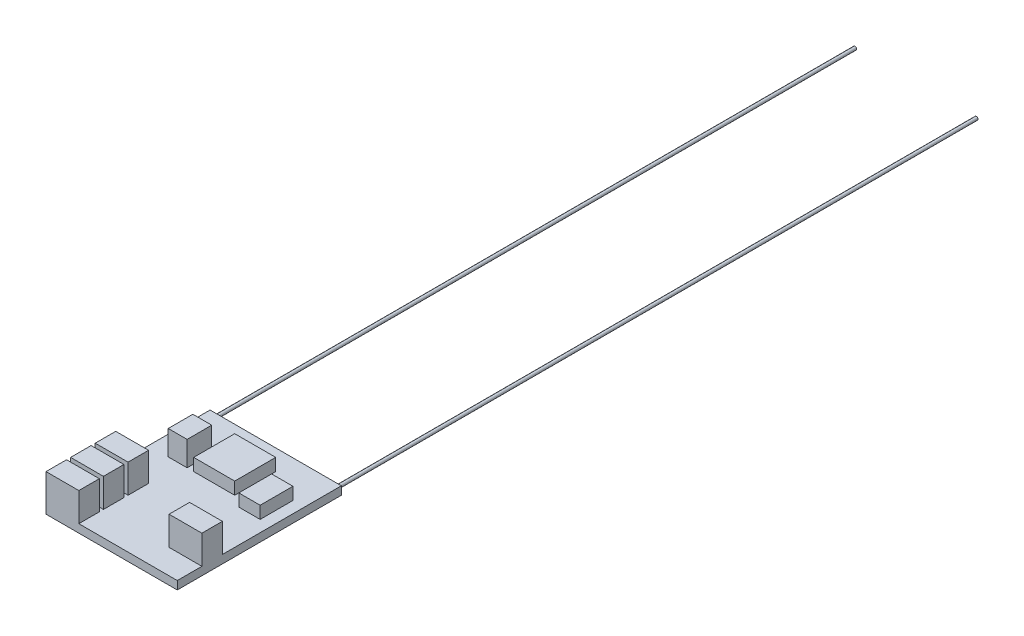
from build123d import *

# Parameters (mm, degrees)
SKETCH1_W           = 16
SKETCH1_H           = 20
BOSS_EXTRUDE1_DEPTH = 1
SKETCH2_W           = 4
SKETCH2_H           = 2.5
BOSS_EXTRUDE2_DEPTH = 3.5
SKETCH3_W           = 5
SKETCH3_H           = 5
SKETCH3_W_2         = 2.6
SKETCH3_H_2         = 4
BOSS_EXTRUDE3_DEPTH = 1.5
SKETCH4_W           = 2.302574488
SKETCH4_H           = 3
BOSS_EXTRUDE4_DEPTH = 3
SKETCH5_R           = 0.2
BOSS_EXTRUDE5_DEPTH = 78


with BuildPart() as part:
    # Sketch1 → Boss-Extrude1 (new body)
    with BuildSketch(Plane(origin=(0, 0, 0), x_dir=(1, 0, 0), z_dir=(0, 1, 0))):
        Rectangle(SKETCH1_W, SKETCH1_H)
    extrude(amount=BOSS_EXTRUDE1_DEPTH)

    # Sketch2 → Boss-Extrude2 (add)
    with BuildSketch(Plane(origin=(0, 1, 0), x_dir=(1, 0, 0), z_dir=(0, 1, 0))):
        with Locations((-6, -5.75)):
            Rectangle(SKETCH2_W, SKETCH2_H)
        with Locations((-6, -8.75)):
            Rectangle(SKETCH2_W, SKETCH2_H)
        with Locations((-6, -2.75)):
            Rectangle(SKETCH2_W, SKETCH2_H)
        with Locations((6, -5.75)):
            Rectangle(SKETCH2_W, SKETCH2_H)
    extrude(amount=BOSS_EXTRUDE2_DEPTH)

    # Sketch3 → Boss-Extrude3 (add)
    with BuildSketch(Plane(origin=(0, 1, 0), x_dir=(1, 0, 0), z_dir=(0, 1, 0))):
        with Locations((0, 5)):
            Rectangle(SKETCH3_W, SKETCH3_H)
        with Locations((5.3, 3.5)):
            Rectangle(SKETCH3_W_2, SKETCH3_H_2)
    extrude(amount=BOSS_EXTRUDE3_DEPTH)

    # Sketch4 → Boss-Extrude4 (add)
    with BuildSketch(Plane(origin=(0, 1, 0), x_dir=(1, 0, 0), z_dir=(0, 1, 0))):
        with Locations((-4.451287244, 4)):
            Rectangle(SKETCH4_W, SKETCH4_H)
    extrude(amount=BOSS_EXTRUDE4_DEPTH)

    # Sketch5 → Boss-Extrude5 (add)
    with BuildSketch(Plane(origin=(0, 0, -10), x_dir=(-1, 0, 0), z_dir=(0, 0, -1))):
        with Locations(Location((7.4, 0.5, 0), (0, 0, 180))):
            Circle(SKETCH5_R)
        with Locations(Location((-7.4, 0.5, 0), (0, 0, 180))):
            Circle(SKETCH5_R)
    extrude(amount=BOSS_EXTRUDE5_DEPTH)


solid = part.part
